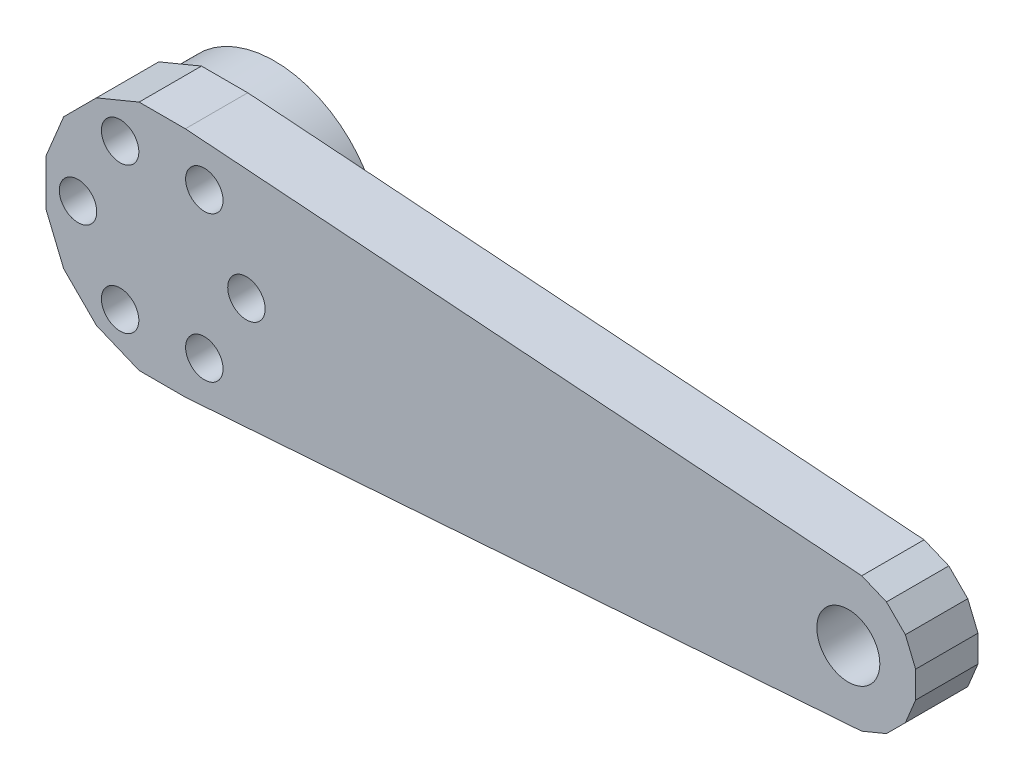
from build123d import *

# Parameters (mm, degrees)
ARM_WEB_START               = 8
PROFILE_1_R                 = 5.05
PROFILE_1_R_2               = 1.65
ARM_WEB_DEPTH               = 10
PROFILE_2_R                 = 17.2
PROFILE_2_R_2               = 5
PROFILE_2_R_3               = 1.65
ROTOR_STANDOFF_DEPTH        = 8
ROTOR_SCREW_SPOTFACES_START = 12
PROFILE_3_R                 = 3
ROTOR_SCREW_SPOTFACES_DEPTH = 6.01


with BuildPart() as part:
    # Profile_1 → Arm_web (new body)
    with BuildSketch(Plane.XY.offset(ARM_WEB_START)):
        Polygon((112.145993542, 10.788638084), (3.706716118, 18.634920328), (-3.706716118, 18.634920328), (-10.555834427, 15.797922634), (-15.797922634, 10.555834427), (-18.634920328, 3.706716118), (-18.634920328, -3.706716118), (-15.797922634, -10.555834427), (-10.555834427, -15.797922634), (-3.706716118, -18.634920328), (3.706716118, -18.634920328), (112.145993542, -10.788638084), (116.111272563, -9.146165735), (119.146165735, -6.111272563), (120.788638084, -2.145993542), (120.788638084, 2.145993542), (119.146165735, 6.111272563), (116.111272563, 9.146165735), align=None)
        with Locations((110, 0)):
            Circle(PROFILE_1_R, mode=Mode.SUBTRACT)
        with Locations((13.5, 0)):
            Circle(PROFILE_1_R_2, mode=Mode.SUBTRACT)
        with Locations((6.75, 11.691342951)):
            Circle(PROFILE_1_R_2, mode=Mode.SUBTRACT)
        with Locations((-6.75, 11.691342951)):
            Circle(PROFILE_1_R_2, mode=Mode.SUBTRACT)
        with Locations((-13.5, 0)):
            Circle(PROFILE_1_R_2, mode=Mode.SUBTRACT)
        with Locations((-6.75, -11.691342951)):
            Circle(PROFILE_1_R_2, mode=Mode.SUBTRACT)
        with Locations((6.75, -11.691342951)):
            Circle(PROFILE_1_R_2, mode=Mode.SUBTRACT)
    extrude(amount=ARM_WEB_DEPTH)

    # Profile_2 → Rotor_standoff (add)
    with BuildSketch(Plane.XY):
        Circle(PROFILE_2_R)
        Circle(PROFILE_2_R_2, mode=Mode.SUBTRACT)
        with Locations((13.5, 0)):
            Circle(PROFILE_2_R_3, mode=Mode.SUBTRACT)
        with Locations((6.75, 11.691342951)):
            Circle(PROFILE_2_R_3, mode=Mode.SUBTRACT)
        with Locations((-6.75, 11.691342951)):
            Circle(PROFILE_2_R_3, mode=Mode.SUBTRACT)
        with Locations((-13.5, 0)):
            Circle(PROFILE_2_R_3, mode=Mode.SUBTRACT)
        with Locations((-6.75, -11.691342951)):
            Circle(PROFILE_2_R_3, mode=Mode.SUBTRACT)
        with Locations((6.75, -11.691342951)):
            Circle(PROFILE_2_R_3, mode=Mode.SUBTRACT)
    extrude(amount=ROTOR_STANDOFF_DEPTH)

    # Profile_3 → Rotor_screw_spotfaces (cut)
    with BuildSketch(Plane.XY.offset(ROTOR_SCREW_SPOTFACES_START)):
        with Locations(Location((13.5, 0, 0), (0, 0, 180))):
            Circle(PROFILE_3_R)
        with Locations(Location((6.75, 11.691342951, 0), (0, 0, 180))):
            Circle(PROFILE_3_R)
        with Locations(Location((-6.75, 11.691342951, 0), (0, 0, 180))):
            Circle(PROFILE_3_R)
        with Locations(Location((-13.5, 0, 0), (0, 0, 180))):
            Circle(PROFILE_3_R)
        with Locations(Location((-6.75, -11.691342951, 0), (0, 0, 180))):
            Circle(PROFILE_3_R)
        with Locations(Location((6.75, -11.691342951, 0), (0, 0, 180))):
            Circle(PROFILE_3_R)
    extrude(amount=ROTOR_SCREW_SPOTFACES_DEPTH, mode=Mode.SUBTRACT)


solid = part.part
